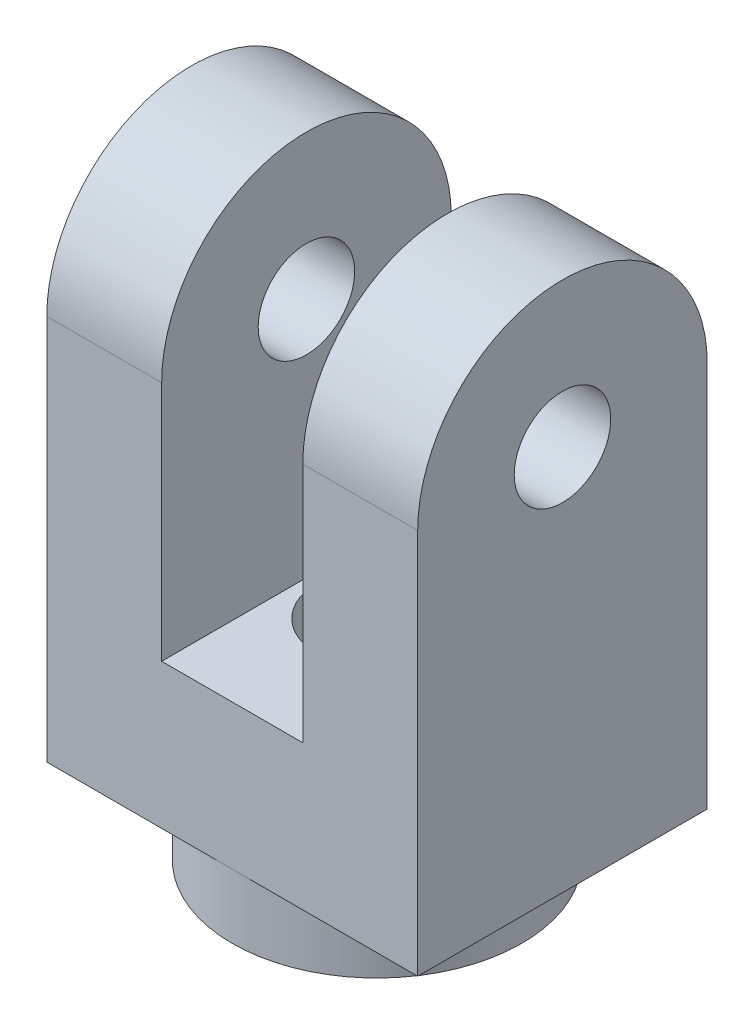
from build123d import *

# Parameters (mm, degrees)
SKETCH1_W           = 92.25
SKETCH1_H           = 72
SKETCH1_R           = 15
BOSS_EXTRUDE1_DEPTH = 36
BOSS_EXTRUDE2_START = -16
SKETCH1_3_R         = 15
BOSS_EXTRUDE2_DEPTH = 16
SKETCH2_R           = 12
BOSS_EXTRUDE3_DEPTH = 28.575


with BuildPart() as part:
    # Sketch1 → Boss-Extrude1 (new body)
    with BuildSketch(Plane(origin=(0, 0, 0), x_dir=(1, 0, 0), z_dir=(0, 1, 0))):
        Rectangle(SKETCH1_W, SKETCH1_H)
        Circle(SKETCH1_R, mode=Mode.SUBTRACT)
    boss_extrude1 = extrude(amount=BOSS_EXTRUDE1_DEPTH)

    # Sketch1<3> → Boss-Extrude2 (add)
    with BuildSketch(Plane(origin=(0, 0, 0), x_dir=(1, 0, 0), z_dir=(0, 1, 0)).offset(BOSS_EXTRUDE2_START)):
        with BuildLine():
            ThreePointArc((36, 0), (25.455844112, 25.455844134), (-3.1e-08, 36))
            ThreePointArc((-3.1e-08, 36), (-36, -3.6e-08), (4.1e-08, -36))
            ThreePointArc((4.1e-08, -36), (25.455844137, -25.455844108), (36, 0))
        make_face()
        Circle(SKETCH1_3_R, mode=Mode.SUBTRACT)
    extrude(amount=BOSS_EXTRUDE2_DEPTH)

    # Sketch2 → Boss-Extrude3 (add)
    with BuildSketch(Plane.ZY.offset(46.125)):
        with BuildLine():
            Line((-36, 36), (36, 36))
            Line((36, 36), (36, 96))
            ThreePointArc((36, 96), (0, 132), (-36, 96))
            Line((-36, 96), (-36, 36))
        make_face()
        with Locations((0, 96)):
            Circle(SKETCH2_R, mode=Mode.SUBTRACT)
    boss_extrude3 = extrude(amount=-BOSS_EXTRUDE3_DEPTH)

    # Mirror1: Boss-Extrude1, Boss-Extrude3 across plane
    add(boss_extrude1.mirror(Plane(origin=(0, 0, 0), x_dir=(0, 0, 1), z_dir=(1, 0, 0))))
    add(boss_extrude3.mirror(Plane(origin=(0, 0, 0), x_dir=(0, 0, 1), z_dir=(1, 0, 0))))


solid = part.part
